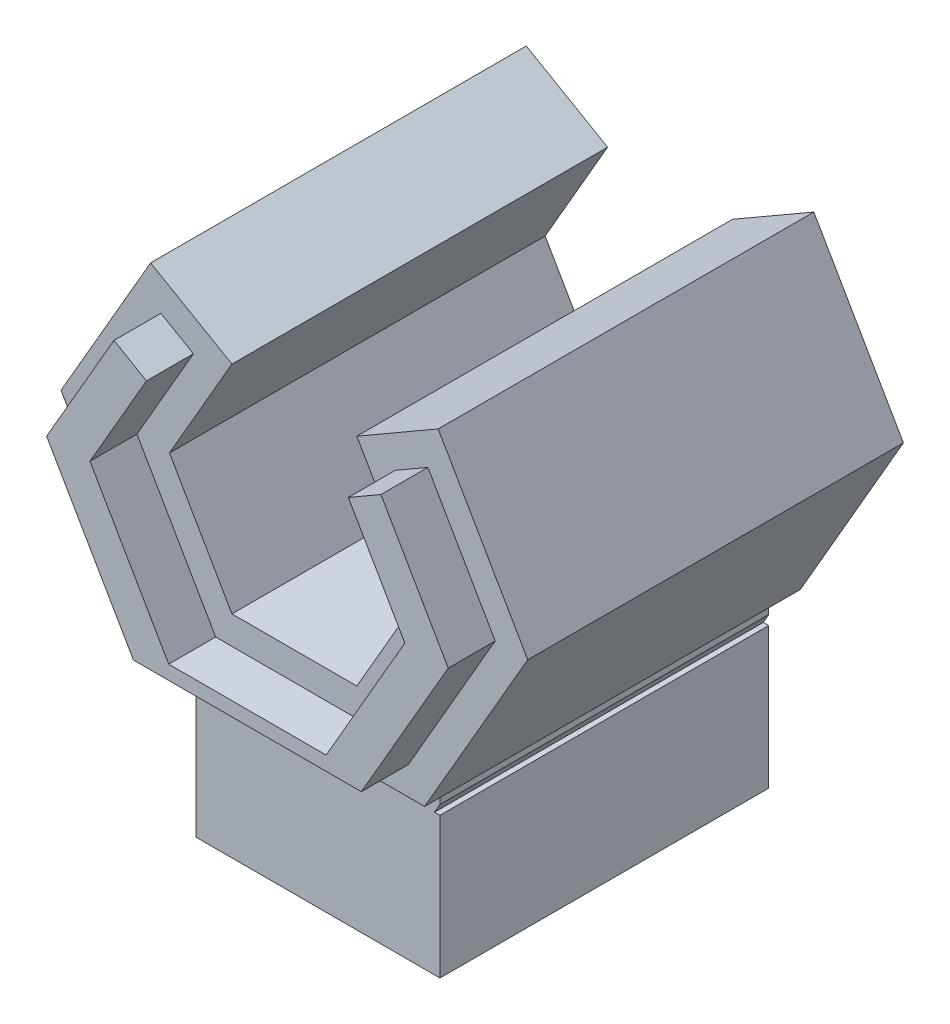
from build123d import *

# Parameters (mm, degrees)
EXTRUDE_1_DEPTH      = 8
SKETCH_2_W           = 9
SKETCH_2_H           = 8
EXTRUDE_2_DEPTH      = 3
SKETCH_3_OUTSIDE_W   = 15.256
SKETCH_3_OUTSIDE_H   = 13.318
SKETCH_3_OUTSIDE_W_2 = 5.2
SKETCH_3_OUTSIDE_H_2 = 7
SKETCH_3_OUTSIDE_W_3 = 2
SKETCH_3_OUTSIDE_H_3 = 5
CUT_EXTRUDE_1_DEPTH  = 3.5
EXTRUDE_3_DEPTH      = 1


with BuildPart() as part:
    # 草图1 → 凸台-拉伸1 (new body)
    with BuildSketch(Plane.XY):
        Polygon((-3.062050808, 3.303627574), (-4.969401077, 0), (-2.484700538, -4.303627574), (2.484700538, -4.303627574), (4.969401077, 0), (3.062050808, 3.303627574), (1.33, 2.303627574), (2.66, 0), (1.33, -2.303627574), (-1.33, -2.303627574), (-2.66, 0), (-1.33, 2.303627574), align=None)
    extrude(amount=EXTRUDE_1_DEPTH)

    # 草图2 → 凸台-拉伸2 (add)
    with BuildSketch(Plane.XZ.offset(4.303627574)):
        with Locations((0, 4)):
            Rectangle(SKETCH_2_W, SKETCH_2_H)
    extrude(amount=EXTRUDE_2_DEPTH)

    # 草图3 outside → 切除-拉伸1 (cut)
    # profile 1 of 2: a face of its own
    with BuildSketch(Plane.XZ.offset(7.303627574)):
        with Locations((0, 4)):
            Rectangle(SKETCH_3_OUTSIDE_W, SKETCH_3_OUTSIDE_H)
        with Locations((0, 4)):
            Rectangle(SKETCH_3_OUTSIDE_W_2, SKETCH_3_OUTSIDE_H_2, mode=Mode.SUBTRACT)
    # profile 2 of 2: a face of its own
    with BuildSketch(Plane.XZ.offset(7.303627574)):
        with Locations((0, 4)):
            Rectangle(SKETCH_3_OUTSIDE_W_3, SKETCH_3_OUTSIDE_H_3)
    extrude(amount=-CUT_EXTRUDE_1_DEPTH, mode=Mode.SUBTRACT)

    # 草图4 → 凸台-拉伸3 (add)
    with BuildSketch(Plane.XY.offset(8)):
        Polygon((-4.276580754, 0), (-2.426965511, -3.203627574), (2.426965511, -3.203627574), (4.276580754, 0), (2.842435565, 2.484012332), (2.149615242, 2.084012332), (3.352820323, 0), (1.676410162, -2.903627574), (-1.676410162, -2.903627574), (-3.352820323, 0), (-2.149615242, 2.084012332), (-2.842435565, 2.484012332), align=None)
    extrude(amount=EXTRUDE_3_DEPTH)


solid = part.part
